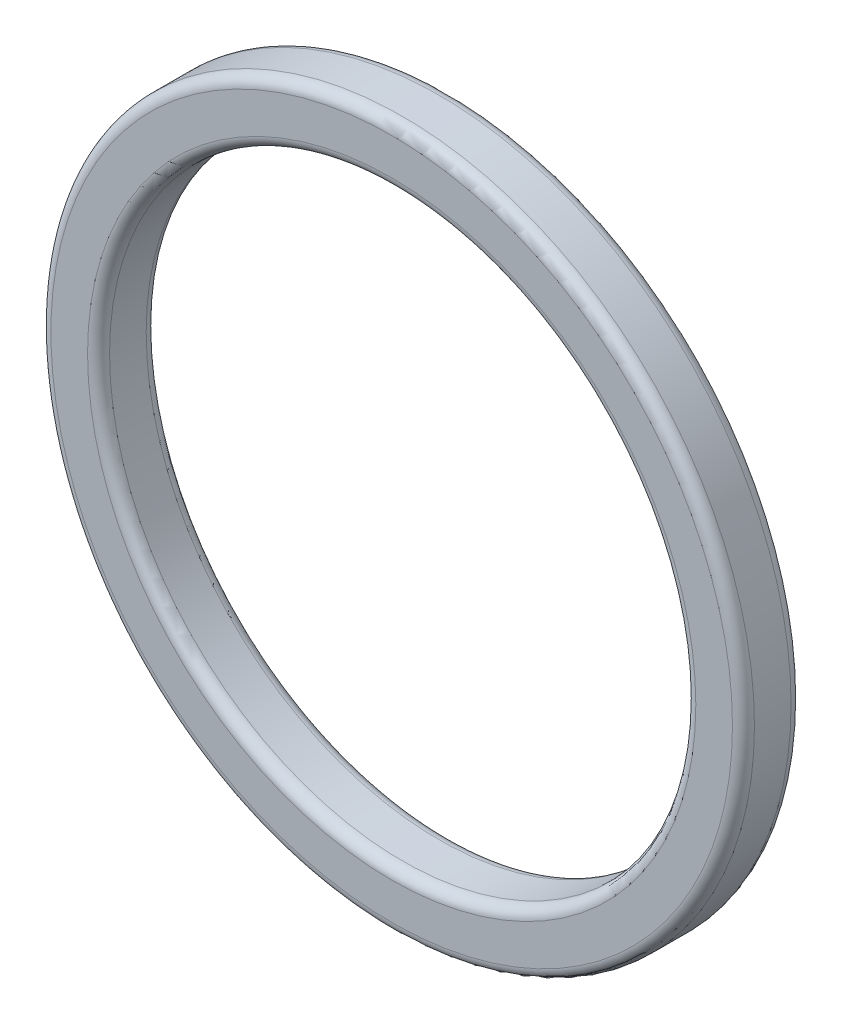
from build123d import *

# Parameters (mm, degrees)
SKETCH_1_R      = 48
SLEEVE_DEPTH    = 8
SKETCH_2_R      = 40
BORE_DEPTH      = 69.352029963
ROUNDED_EDGES_R = 1.5


with BuildPart() as part:
    # 草图1 → Sleeve (new body)
    with BuildSketch(Plane.XY):
        Circle(SKETCH_1_R)
    extrude(amount=SLEEVE_DEPTH)

    # 草图2 → Bore (cut, through all)
    with BuildSketch(Plane.XY.offset(8)):
        Circle(SKETCH_2_R)
    extrude(amount=-BORE_DEPTH, mode=Mode.SUBTRACT)

    # Rounded_edges
    rounded_edges_edges = [part.edges().sort_by_distance(p)[0] for p in [
        (-48, 0, 0),
        (-48, 0, 8),
        (-40, 0, 0),
        (-40, 0, 8),
    ]]
    fillet(rounded_edges_edges, radius=ROUNDED_EDGES_R)


solid = part.part
